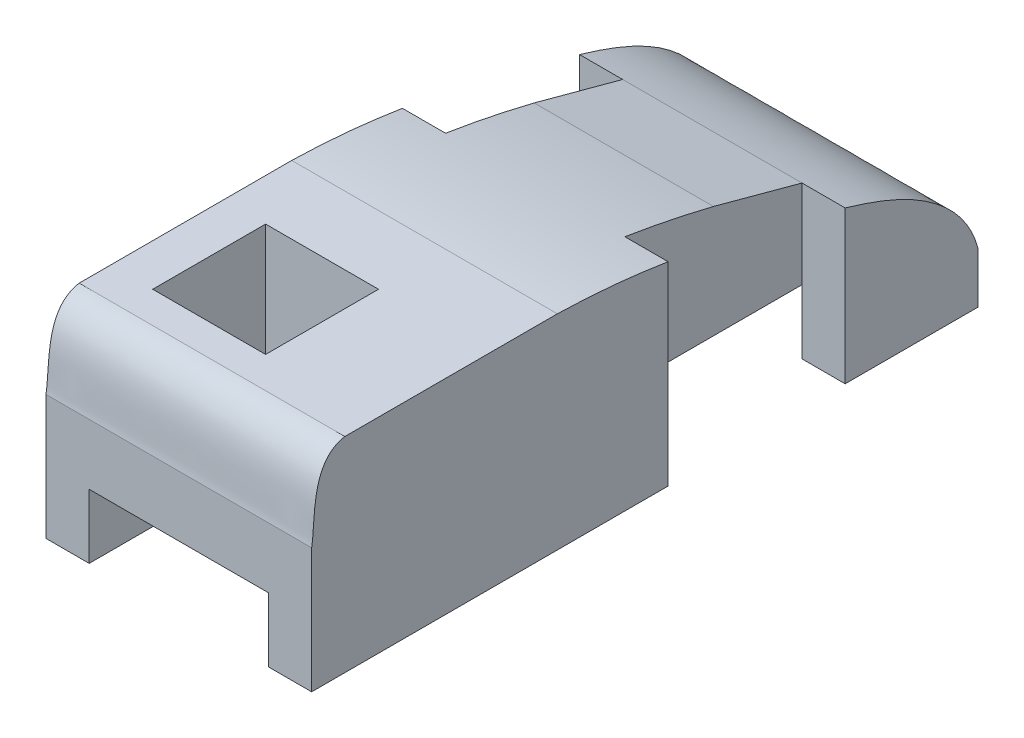
from build123d import *

# Parameters (mm, degrees)
SKETCH_1_W                = 100
SKETCH_1_H                = 185
EXTRUDE_1_DEPTH           = 100
SKETCH_2_W                = 100
SKETCH_2_H                = 3.8
CUT_EXTRUDE_1_DEPTH       = 155
CUT_EXTRUDE_2_DEPTH       = 155
SKETCH_4_W                = 25.5
SKETCH_4_H                = 25.5
CUT_EXTRUDE_3_DEPTH       = 79
SKETCH_6_W                = 89.706259743
SKETCH_6_H                = 10
SKETCH_6_W_2              = 10.293740257
CUT_EXTRUDE_4_DEPTH       = 146.107718609
CUT_EXTRUDE_5_DEPTH       = 169.985946161
CUT_EXTRUDE_5_DEPTH_BACK  = 169.985946161
SKETCH_7_W                = 20
SKETCH_7_H                = 3.8
EXTRUDE_4_DEPTH           = 160
SKETCH_10_W               = 16
SKETCH_10_H               = 1.8
CUT_EXTRUDE_6_DEPTH       = 155
SKETCH_13_W               = 20
SKETCH_13_H               = 175
CUT_EXTRUDE_7_DEPTH       = 143.515578096
SKETCH_14_W               = 175
SKETCH_14_H               = 50
CUT_EXTRUDE_8_DEPTH       = 149.849756466
SKETCH_15_W               = 60
SKETCH_15_H               = 10
CUT_EXTRUDE_9_DEPTH       = 108.660066877
SKETCH_16_W               = 60
SKETCH_16_H               = 14.5
CUT_EXTRUDE_10_DEPTH      = 108.660066877
CUT_EXTRUDE_11_DEPTH      = 111.381157812
CUT_EXTRUDE_21_DEPTH      = 162.400898529
CUT_EXTRUDE_21_DEPTH_BACK = 140.5
CUT_EXTRUDE_26_DEPTH      = 111.381157983
SKETCH_34_W               = 10
SKETCH_34_H               = 20
CUT_EXTRUDE_31_DEPTH      = 96.490523251
SKETCH_35_W               = 18.74373947
SKETCH_35_H               = 80.5
CUT_EXTRUDE_32_DEPTH      = 14
CUT_EXTRUDE_35_DEPTH      = 60
CUT_EXTRUDE_36_DEPTH      = 140.5
SKETCH_43_W               = 0.25
SKETCH_43_H               = 0.002112168
CUT_EXTRUDE_37_DEPTH      = 140.5
SKETCH_44_W               = 7.5
SKETCH_44_H               = 0.502112168
CUT_EXTRUDE_38_DEPTH      = 80.4999
SKETCH_45_W               = 9.75
SKETCH_45_H               = 20
SKETCH_45_W_2             = 9.75146362
CUT_EXTRUDE_39_DEPTH      = 96.490523251
SKETCH_46_W               = 0.24853638
SKETCH_46_H               = 20
SKETCH_46_W_2             = 0.25
EXTRUDE_5_DEPTH           = 31.697888
CUT_EXTRUDE_40_DEPTH      = 106.399537724
CUT_EXTRUDE_40_DEPTH_BACK = 106.399537724
SKETCH_54_W               = 25.5
SKETCH_54_H               = 0.5
CUT_EXTRUDE_41_DEPTH      = 29
SKETCH_55_W               = 26
SKETCH_55_H               = 26
EXTRUDE_6_DEPTH           = 29
SKETCH_56_W               = 25.5
SKETCH_56_H               = 25.5
CUT_EXTRUDE_42_DEPTH      = 29


with BuildPart() as part:
    # 草图1 → 凸台-拉伸1 (new body)
    with BuildSketch(Plane(origin=(0, 0, 0), x_dir=(1, 0, 0), z_dir=(0, 1, 0))):
        Rectangle(SKETCH_1_W, SKETCH_1_H)
    extrude(amount=EXTRUDE_1_DEPTH)

    # 草图2 → 切除-拉伸1 (cut)
    with BuildSketch(Plane.XY.offset(92.5)):
        with Locations((0, 1.9)):
            Rectangle(SKETCH_2_W, SKETCH_2_H)
    extrude(amount=-CUT_EXTRUDE_1_DEPTH, mode=Mode.SUBTRACT)

    # 草图3 → 切除-拉伸2 (cut)
    with BuildSketch(Plane.XY.offset(92.5)):
        with BuildLine():
            Line((-20, 3.8), (-3.51, 3.8))
            ThreePointArc((-3.51, 3.8), (-3.949598778, 3.901619975), (-4.3, 4.185860522))
            Line((-4.3, 4.185860522), (-9.371869735, 10.69267521))
            ThreePointArc((-9.371869735, 10.69267521), (-9.267749528, 11.143089764), (-8.9765156, 11.502112168))
            Line((-8.9765156, 11.502112168), (-4.5, 11.502112168))
            ThreePointArc((-4.5, 11.502112168), (-4.146446609, 11.648558777), (-4, 12.002112168))
            Line((-4, 12.002112168), (-4, 16.002112168))
            Line((-4, 16.002112168), (-20, 16.002112168))
            Line((-20, 16.002112168), (-20, 3.8))
        make_face()
        with BuildLine():
            ThreePointArc((4.3, 4.185860522), (3.949598778, 3.901619975), (3.51, 3.8))
            Line((3.51, 3.8), (20, 3.8))
            Line((20, 3.8), (20, 16.002112168))
            Line((20, 16.002112168), (4, 16.002112168))
            Line((4, 16.002112168), (4, 12.002112168))
            ThreePointArc((4, 12.002112168), (4.146446609, 11.648558777), (4.5, 11.502112168))
            Line((4.5, 11.502112168), (8.9765156, 11.502112168))
            ThreePointArc((8.9765156, 11.502112168), (9.426930154, 11.220838522), (9.371869735, 10.69267521))
            Line((9.371869735, 10.69267521), (4.3, 4.185860522))
        make_face()
    extrude(amount=-CUT_EXTRUDE_2_DEPTH, mode=Mode.SUBTRACT)

    # 草图4 → 切除-拉伸3 (cut)
    with BuildSketch(Plane(origin=(0, 100, 0), x_dir=(1, 0, 0), z_dir=(0, 1, 0))):
        with Locations((7.75, -50.25)):
            Rectangle(SKETCH_4_W, SKETCH_4_H)
    extrude(amount=-CUT_EXTRUDE_3_DEPTH, mode=Mode.SUBTRACT)

    # 草图6 → 切除-拉伸4 (cut, through all)
    with BuildSketch(Plane(origin=(0, 100, 0), x_dir=(1, 0, 0), z_dir=(0, 1, 0))):
        with Locations((5.146870128, 87.5)):
            Rectangle(SKETCH_6_W, SKETCH_6_H)
        with Locations((-44.853129872, 87.5)):
            Rectangle(SKETCH_6_W_2, SKETCH_6_H)
    extrude(amount=-CUT_EXTRUDE_4_DEPTH, mode=Mode.SUBTRACT)

    # 草图7 → 切除-拉伸5 (cut, two sides: drawn at the far end of the back side and taken through both)
    with BuildSketch(Plane.ZY.offset(50).offset(-CUT_EXTRUDE_5_DEPTH_BACK)):
        with Locations((-72.5, 1.9)):
            Rectangle(SKETCH_7_W, SKETCH_7_H)
    extrude(amount=CUT_EXTRUDE_5_DEPTH + CUT_EXTRUDE_5_DEPTH_BACK, mode=Mode.SUBTRACT)

    # 草图9 → 凸台-拉伸4 (add)
    with BuildSketch(Plane.XY.offset(92.5)):
        Polygon((-9.371869735, 10.69267521), (-9.371869735, 13.29267521), (-4, 13.29267521), (4, 13.29267521), (9.371869735, 13.29267521), (9.371869735, 10.69267521), align=None)
    extrude(amount=-EXTRUDE_4_DEPTH)

    # 草图10 → 切除-拉伸6 (cut)
    with BuildSketch(Plane.XY.offset(92.5)):
        with Locations((-12, 16.902112168)):
            Rectangle(SKETCH_10_W, SKETCH_10_H)
        Polygon((4, 16.002112168), (4, 17.802112168), (19.99853638, 17.802112168), (20, 16.002112168), align=None)
    extrude(amount=-CUT_EXTRUDE_6_DEPTH, mode=Mode.SUBTRACT)

    # 草图13 → 切除-拉伸7 (cut, through all)
    with BuildSketch(Plane.XZ.offset(-3.8)):
        with Locations((-40, 5)):
            Rectangle(SKETCH_13_W, SKETCH_13_H)
        with Locations((40, 5)):
            Rectangle(SKETCH_13_W, SKETCH_13_H)
    extrude(amount=-CUT_EXTRUDE_7_DEPTH, mode=Mode.SUBTRACT)

    # 草图14 → 切除-拉伸8 (cut, through all)
    with BuildSketch(Plane(origin=(30, 0, 0), x_dir=(0, 0, -1), z_dir=(1, 0, 0))):
        with Locations((-5, 75)):
            Rectangle(SKETCH_14_W, SKETCH_14_H)
    extrude(amount=-CUT_EXTRUDE_8_DEPTH, mode=Mode.SUBTRACT)

    # 草图15 → 切除-拉伸9 (cut, through all)
    with BuildSketch(Plane.XZ.offset(-3.8)):
        with Locations((0, -77.5)):
            Rectangle(SKETCH_15_W, SKETCH_15_H)
    extrude(amount=-CUT_EXTRUDE_9_DEPTH, mode=Mode.SUBTRACT)

    # 草图16 → 切除-拉伸10 (cut, through all)
    with BuildSketch(Plane(origin=(0, 50, 0), x_dir=(1, 0, 0), z_dir=(0, 1, 0))):
        with Locations((0, -85.25)):
            Rectangle(SKETCH_16_W, SKETCH_16_H)
    extrude(amount=-CUT_EXTRUDE_10_DEPTH, mode=Mode.SUBTRACT)

    # 草图17 → 切除-拉伸11 (cut, through all)
    with BuildSketch(Plane(origin=(30, 0, 0), x_dir=(0, 0, -1), z_dir=(1, 0, 0))):
        with BuildLine():
            Line((72.5, 50), (-22.5, 50))
            add(Edge.make_bspline(
                [(-22.5, 50), (-9.330669895, 49.706144403), (11.085821801, 46.827148239), (38.239751221, 39.498978447), (59.688603115, 33.272875951), (70.679662454, 22.295526596), (72.5, 15.311284203)],
                knots=[0, 0, 0, 0, 0.374533404, 0.581855131, 0.802431491, 1, 1, 1, 1], degree=3))
            Line((72.5, 15.311284203), (72.5, 50))
        make_face()
    extrude(amount=-CUT_EXTRUDE_11_DEPTH, mode=Mode.SUBTRACT)

    # 草图24 → 切除-拉伸21 (cut, two sides: drawn at the far end of the back side and taken through both)
    with BuildSketch(Plane.XY.offset(78).offset(-CUT_EXTRUDE_21_DEPTH_BACK)):
        with BuildLine():
            Line((9.371869735, 11.309008937), (9.371869735, 10.69267521))
            ThreePointArc((9.371869735, 10.69267521), (9.477785695, 11.000842073), (9.371869735, 11.309008937))
        make_face()
    extrude(amount=CUT_EXTRUDE_21_DEPTH + CUT_EXTRUDE_21_DEPTH_BACK, mode=Mode.SUBTRACT)

    # 草图28 → 切除-拉伸26 (cut, through all)
    with BuildSketch(Plane(origin=(30, 0, 0), x_dir=(0, 0, -1), z_dir=(1, 0, 0))):
        with BuildLine():
            Line((-70.5, 50), (-78, 50))
            Line((-78, 50), (-78, 31.982866201))
            add(Edge.make_bspline(
                [(-70.5, 50), (-78.410932033, 48.656434308), (-77.0737544, 36.843285786), (-78, 31.982866201)],
                knots=[0, 0, 0, 0, 1, 1, 1, 1], degree=3))
        make_face()
    extrude(amount=-CUT_EXTRUDE_26_DEPTH, mode=Mode.SUBTRACT)

    # 草图34 → 切除-拉伸31 (cut, through all)
    with BuildSketch(Plane.XZ.offset(-3.8)):
        with Locations((-25, -32.5)):
            Rectangle(SKETCH_34_W, SKETCH_34_H)
        with Locations((25, -32.5)):
            Rectangle(SKETCH_34_W, SKETCH_34_H)
    extrude(amount=-CUT_EXTRUDE_31_DEPTH, mode=Mode.SUBTRACT)

    # 草图35 → 切除-拉伸32 (cut)
    with BuildSketch(Plane.XZ.offset(-3.8)):
        with Locations((0, 37.75)):
            Rectangle(SKETCH_35_W, SKETCH_35_H)
    extrude(amount=-CUT_EXTRUDE_32_DEPTH, mode=Mode.SUBTRACT)

    # 草图40 → 切除-拉伸35 (cut)
    with BuildSketch(Plane.XY.offset(-2.5)):
        Polygon((4, 13.29267521), (4, 17.8), (3.75, 17.8), (3.75, 12.79267521), (9.371869735, 12.79267521), (9.371869735, 13.29267521), align=None)
        Polygon((-3.75, 17.8), (-4, 17.8), (-4, 13.29267521), (-9.371869735, 13.29267521), (-9.371869735, 12.79267521), (-3.75, 12.79267521), align=None)
    extrude(amount=-CUT_EXTRUDE_35_DEPTH, mode=Mode.SUBTRACT)

    # 草图41 → 切除-拉伸36 (cut)
    with BuildSketch(Plane.XY.offset(78)):
        Polygon((-3.75, 18.302112168), (-20.25, 18.302112168), (-20.25, 3.8), (-20, 3.8), (-20, 17.802112168), (-3.75, 17.802112168), align=None)
        Polygon((3.75, 18.302112168), (3.75, 17.802112168), (19.99853638, 17.802112168), (19.99853638, 3.8), (20.24853638, 3.8), (20.24853638, 18.302112168), align=None)
    extrude(amount=-CUT_EXTRUDE_36_DEPTH, mode=Mode.SUBTRACT)

    # 草图43 → 切除-拉伸37 (cut)
    with BuildSketch(Plane.XY.offset(78)):
        with Locations((-3.875, 17.801056084)):
            Rectangle(SKETCH_43_W, SKETCH_43_H)
        with Locations((3.875, 17.801056084)):
            Rectangle(SKETCH_43_W, SKETCH_43_H)
    extrude(amount=-CUT_EXTRUDE_37_DEPTH, mode=Mode.SUBTRACT)

    # 草图44 → 切除-拉伸38 (cut)
    with BuildSketch(Plane.XY.offset(78)):
        with Locations((0, 18.051056084)):
            Rectangle(SKETCH_44_W, SKETCH_44_H)
    extrude(amount=-CUT_EXTRUDE_38_DEPTH, mode=Mode.SUBTRACT)

    # 草图45 → 切除-拉伸39 (cut, through all)
    with BuildSketch(Plane.XZ.offset(-3.8)):
        with Locations((-25.125, -12.5)):
            Rectangle(SKETCH_45_W, SKETCH_45_H)
        with Locations((25.12426819, -12.5)):
            Rectangle(SKETCH_45_W_2, SKETCH_45_H)
    extrude(amount=-CUT_EXTRUDE_39_DEPTH, mode=Mode.SUBTRACT)

    # 草图46 → 凸台-拉伸5 (add, through all)
    with BuildSketch(Plane.XZ.offset(-18.302112168)):
        with Locations((20.12426819, -32.5)):
            Rectangle(SKETCH_46_W, SKETCH_46_H)
        with Locations((-20.125, -32.5)):
            Rectangle(SKETCH_46_W_2, SKETCH_46_H)
    extrude(amount=-EXTRUDE_5_DEPTH)

    # 草图47 → 切除-拉伸40 (cut, two sides: drawn at the far end of the back side and taken through both)
    with BuildSketch(Plane.ZY.offset(20.25).offset(-CUT_EXTRUDE_40_DEPTH_BACK)):
        Polygon((-42.5, 38.203961841), (-22.5, 43.618048783), (-22.5, 50), (-42.5, 50), align=None)
    extrude(amount=CUT_EXTRUDE_40_DEPTH + CUT_EXTRUDE_40_DEPTH_BACK, mode=Mode.SUBTRACT)

    # 草图54 → 切除-拉伸41 (cut)
    with BuildSketch(Plane(origin=(0, 50, 0), x_dir=(1, 0, 0), z_dir=(0, 1, 0))):
        with Locations((7.75, -37.25)):
            Rectangle(SKETCH_54_W, SKETCH_54_H)
        Polygon((-5, -63), (-5, -37.5), (-5, -37), (-5.5, -37), (-5.5, -63), align=None)
    extrude(amount=-CUT_EXTRUDE_41_DEPTH, mode=Mode.SUBTRACT)

    # 草图55 → 凸台-拉伸6 (add)
    with BuildSketch(Plane(origin=(0, 50, 0), x_dir=(1, 0, 0), z_dir=(0, 1, 0))):
        with Locations((7.5, -50)):
            Rectangle(SKETCH_55_W, SKETCH_55_H)
    extrude(amount=-EXTRUDE_6_DEPTH)

    # 草图56 → 切除-拉伸42 (cut)
    with BuildSketch(Plane(origin=(0, 50, 0), x_dir=(1, 0, 0), z_dir=(0, 1, 0))):
        with Locations((-7.75, -50.65)):
            Rectangle(SKETCH_56_W, SKETCH_56_H)
    extrude(amount=-CUT_EXTRUDE_42_DEPTH, mode=Mode.SUBTRACT)


solid = part.part
